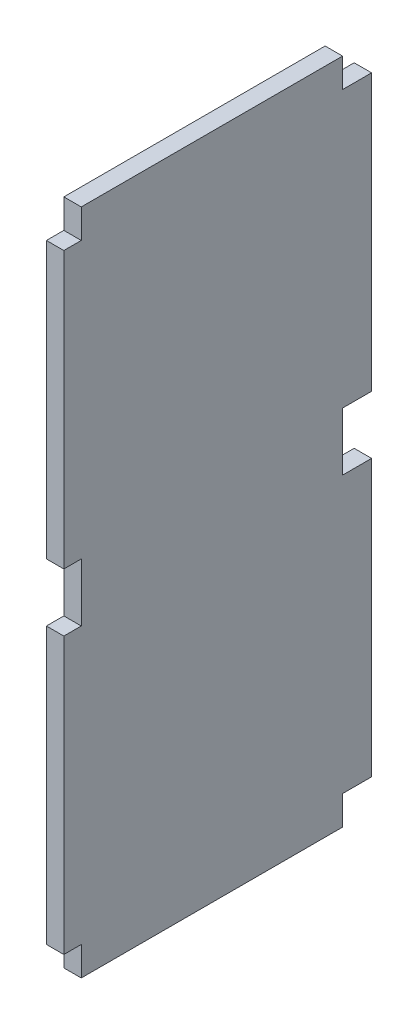
from build123d import *

# Parameters (mm, degrees)
ESTRUSIONE_ESTRUSIONE1_DEPTH      = 48
ESTRUSIONE_ESTRUSIONE1_DEPTH_BACK = 5
SCHIZZO1_W                        = 3
SCHIZZO1_H                        = 105
TAGLIO_ESTRUSIONE1_DEPTH          = 10
SCHIZZO3_W                        = 3
SCHIZZO3_H                        = 45
ESTRUSIONE_ESTRUSIONE2_DEPTH      = 5


with BuildPart() as part:
    # Schizzo1 → Estrusione-Estrusione1 (new, two sides: drawn at the far end of the back side and taken through both)
    with BuildSketch(Plane.XY.offset(-ESTRUSIONE_ESTRUSIONE1_DEPTH_BACK)):
        with Locations((5, 0)):
            Rectangle(SCHIZZO1_W, SCHIZZO1_H)
    extrude(amount=ESTRUSIONE_ESTRUSIONE1_DEPTH + ESTRUSIONE_ESTRUSIONE1_DEPTH_BACK)

    # Schizzo2 → Taglio-Estrusione1 (cut)
    with BuildSketch(Plane(origin=(6.5, 0, 0), x_dir=(0, 0, -1), z_dir=(1, 0, 0))):
        Polygon((-48, -5), (-45, -5), (-45, 0), (-45, 5), (-48, 5), align=None)
        Polygon((5, -5), (0, -5), (0, 0), (0, 5), (5, 5), align=None)
    extrude(amount=-TAGLIO_ESTRUSIONE1_DEPTH, mode=Mode.SUBTRACT)

    # Schizzo3 → Estrusione-Estrusione2 (add)
    with BuildSketch(Plane.XZ.offset(52.5)):
        with Locations((5, 22.5)):
            Rectangle(SCHIZZO3_W, SCHIZZO3_H)
    estrusione_estrusione2 = extrude(amount=ESTRUSIONE_ESTRUSIONE2_DEPTH)

    # Specchia1: Estrusione-Estrusione2 across plane
    add(estrusione_estrusione2.mirror(Plane(origin=(0, 0, 0), x_dir=(0, 0, 1), z_dir=(0, -1, 0))))


solid = part.part
